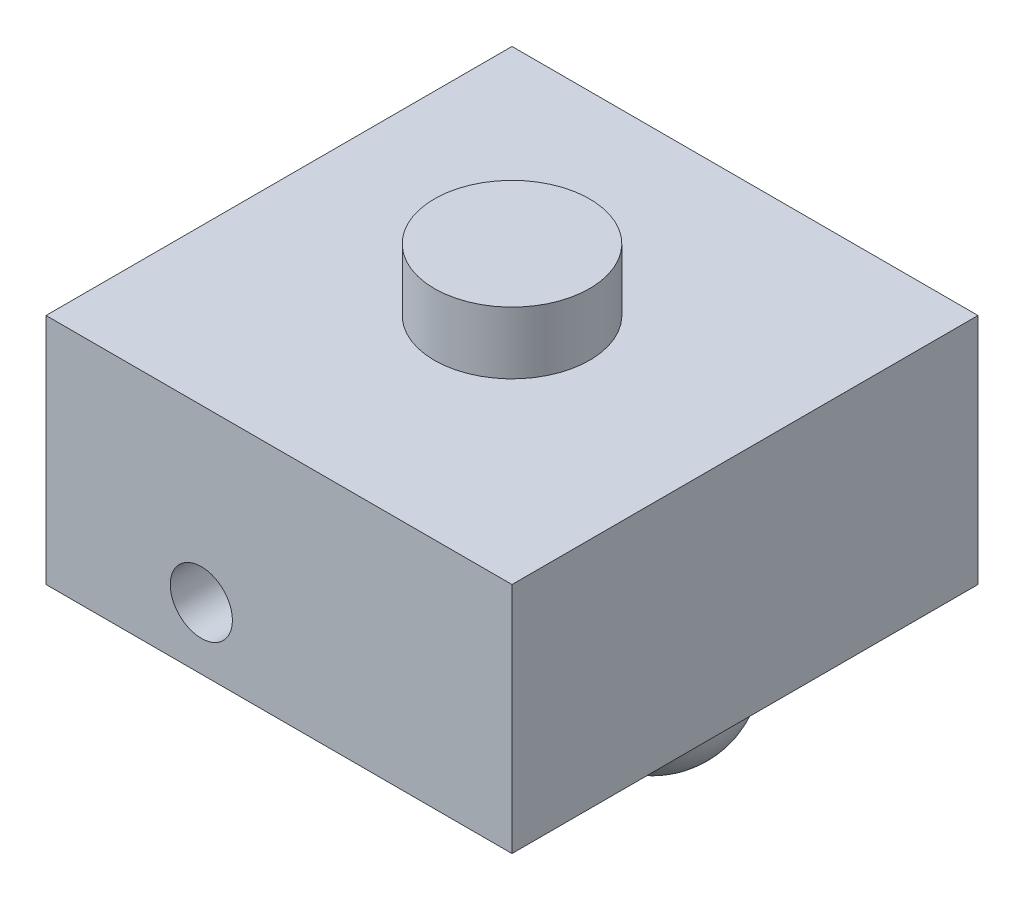
from build123d import *

# Parameters (mm, degrees)
SKETCH2_W           = 300
SKETCH2_H           = 300
BOSS_EXTRUDE1_DEPTH = 150
SKETCH4_R           = 20
CUT_EXTRUDE1_DEPTH  = 368.423461417
SKETCH8_R           = 50
BOSS_EXTRUDE3_DEPTH = 40
SKETCH10_R          = 50
BOSS_EXTRUDE4_DEPTH = 50
FILLET1_R           = 49


with BuildPart() as part:
    # Sketch2 → Boss-Extrude1 (new body)
    with BuildSketch(Plane(origin=(0, 0, 0), x_dir=(1, 0, 0), z_dir=(0, 1, 0))):
        Rectangle(SKETCH2_W, SKETCH2_H)
    extrude(amount=BOSS_EXTRUDE1_DEPTH)

    # Sketch4 → Cut-Extrude1 (cut, through all)
    with BuildSketch(Plane.XY.offset(150)):
        with Locations((-50, 40)):
            Circle(SKETCH4_R)
    extrude(amount=-CUT_EXTRUDE1_DEPTH, mode=Mode.SUBTRACT)

    # Sketch8 → Boss-Extrude3 (add)
    with BuildSketch(Plane(origin=(0, 150, 0), x_dir=(1, 0, 0), z_dir=(0, 1, 0))):
        with Locations(Location((0, 0, 0), (0, 0, 270))):
            Circle(SKETCH8_R)
    extrude(amount=BOSS_EXTRUDE3_DEPTH)

    # Sketch10 → Boss-Extrude4 (add)
    with BuildSketch(Plane(origin=(0, 0, 0), x_dir=(-1, 0, 0), z_dir=(0, -1, 0))):
        with Locations(Location((-90, 0, 0), (0, 0, 270))):
            Circle(SKETCH10_R)
    extrude(amount=BOSS_EXTRUDE4_DEPTH)

    # Fillet1
    fillet1_edges = [part.edges().sort_by_distance(p)[0] for p in [
        (90, -50, -50),
    ]]
    fillet(fillet1_edges, radius=FILLET1_R)


solid = part.part
